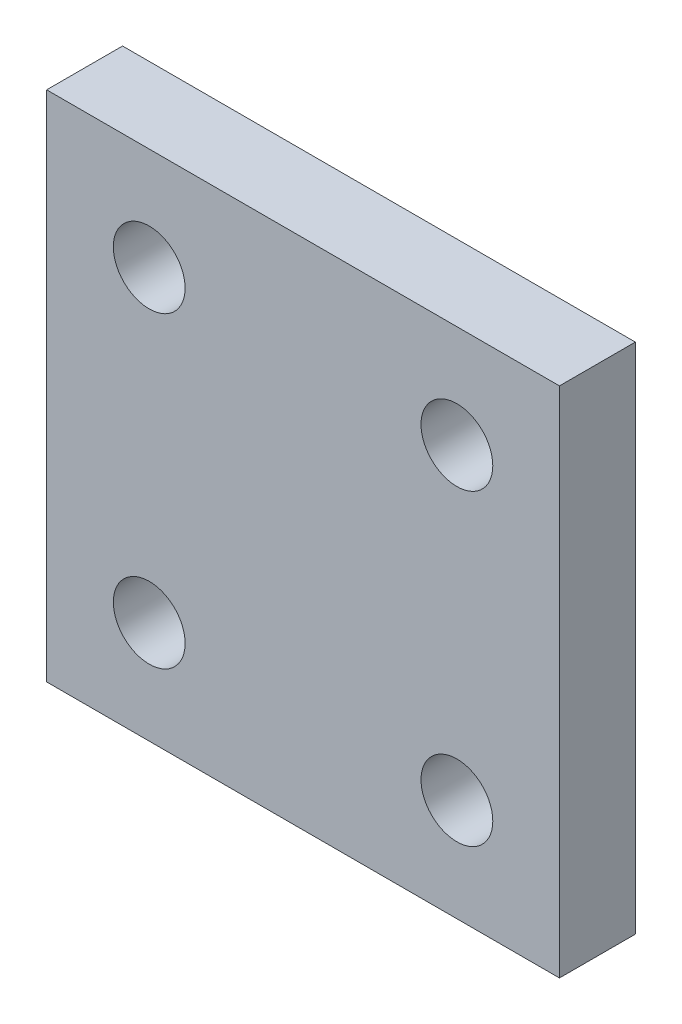
from build123d import *

# Parameters (mm, degrees)
SKETCH_1_W          = 25
SKETCH_1_H          = 25
EXTRUDE_1_DEPTH     = 3.7
SKETCH_2_R          = 1.75
CUT_EXTRUDE_1_DEPTH = 3.7


with BuildPart() as part:
    # 草图1 → 凸台-拉伸1 (new body)
    with BuildSketch(Plane.XY):
        with Locations((12.5, 12.5)):
            Rectangle(SKETCH_1_W, SKETCH_1_H)
    extrude(amount=EXTRUDE_1_DEPTH)

    # 草图2 → 切除-拉伸1 (cut)
    with BuildSketch(Plane.XY.offset(3.7)):
        with Locations((5, 20)):
            Circle(SKETCH_2_R)
        with Locations((20, 20)):
            Circle(SKETCH_2_R)
        with Locations((20, 5)):
            Circle(SKETCH_2_R)
        with Locations((5, 5)):
            Circle(SKETCH_2_R)
    extrude(amount=-CUT_EXTRUDE_1_DEPTH, mode=Mode.SUBTRACT)


solid = part.part
